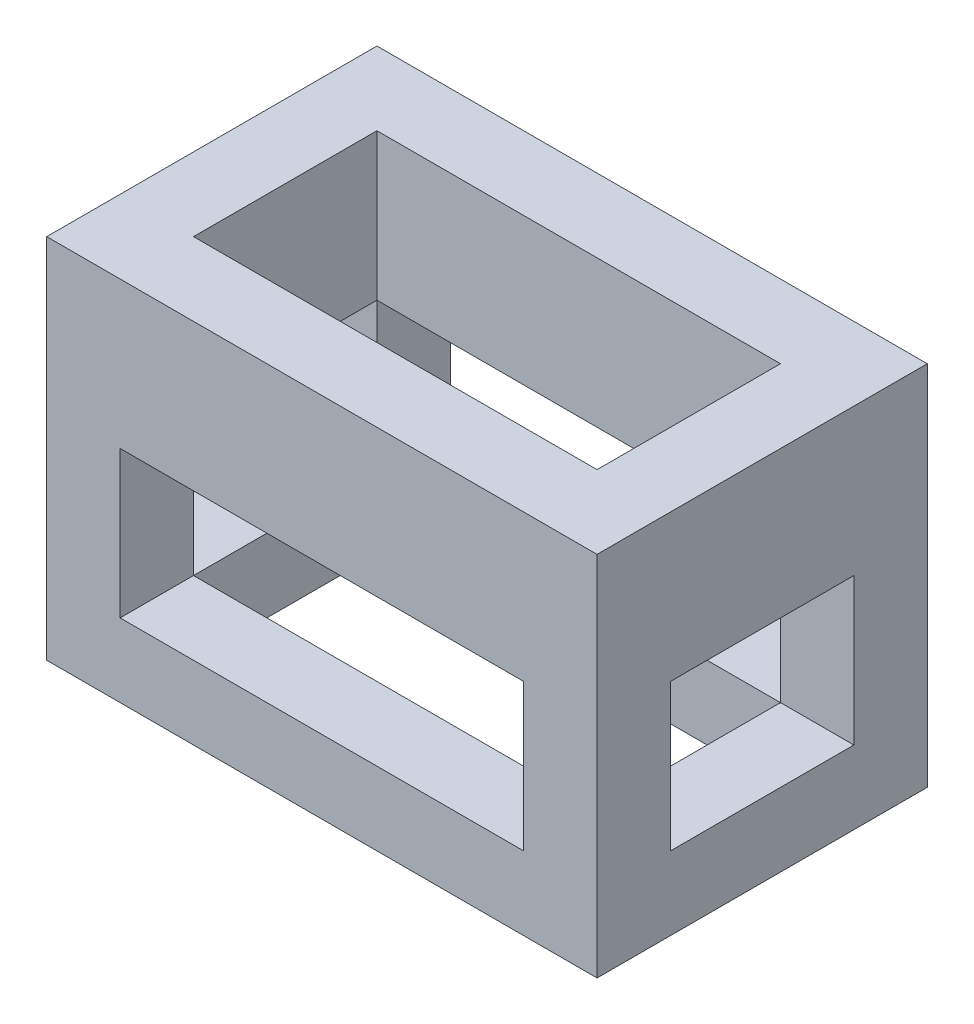
from build123d import *

# Parameters (mm, degrees)
SKETCH1_W           = 190.5
SKETCH1_H           = 114.3
BOSS_EXTRUDE1_DEPTH = 127
SKETCH2_W           = 139.7
SKETCH2_H           = 50.8
CUT_EXTRUDE1_DEPTH  = 196.61710687
SKETCH3_W           = 63.5
SKETCH3_H           = 50.8
CUT_EXTRUDE2_DEPTH  = 236.977483036
SKETCH4_W           = 139.7
SKETCH4_H           = 63.5
CUT_EXTRUDE3_DEPTH  = 169.723694246


with BuildPart() as part:
    # Sketch1 → Boss-Extrude1 (new body)
    with BuildSketch(Plane(origin=(0, 0, 0), x_dir=(1, 0, 0), z_dir=(0, 1, 0))):
        Rectangle(SKETCH1_W, SKETCH1_H)
    extrude(amount=BOSS_EXTRUDE1_DEPTH)

    # Sketch2 → Cut-Extrude1 (cut, through all)
    with BuildSketch(Plane.XY.offset(57.15)):
        with Locations((0, 50.8)):
            Rectangle(SKETCH2_W, SKETCH2_H)
    extrude(amount=-CUT_EXTRUDE1_DEPTH, mode=Mode.SUBTRACT)

    # Sketch3 → Cut-Extrude2 (cut, through all)
    with BuildSketch(Plane(origin=(95.25, 0, 0), x_dir=(0, 0, -1), z_dir=(1, 0, 0))):
        with Locations((0, 50.8)):
            Rectangle(SKETCH3_W, SKETCH3_H)
    extrude(amount=-CUT_EXTRUDE2_DEPTH, mode=Mode.SUBTRACT)

    # Sketch4 → Cut-Extrude3 (cut, through all)
    with BuildSketch(Plane(origin=(0, 127, 0), x_dir=(1, 0, 0), z_dir=(0, 1, 0))):
        Rectangle(SKETCH4_W, SKETCH4_H)
    extrude(amount=-CUT_EXTRUDE3_DEPTH, mode=Mode.SUBTRACT)


solid = part.part
